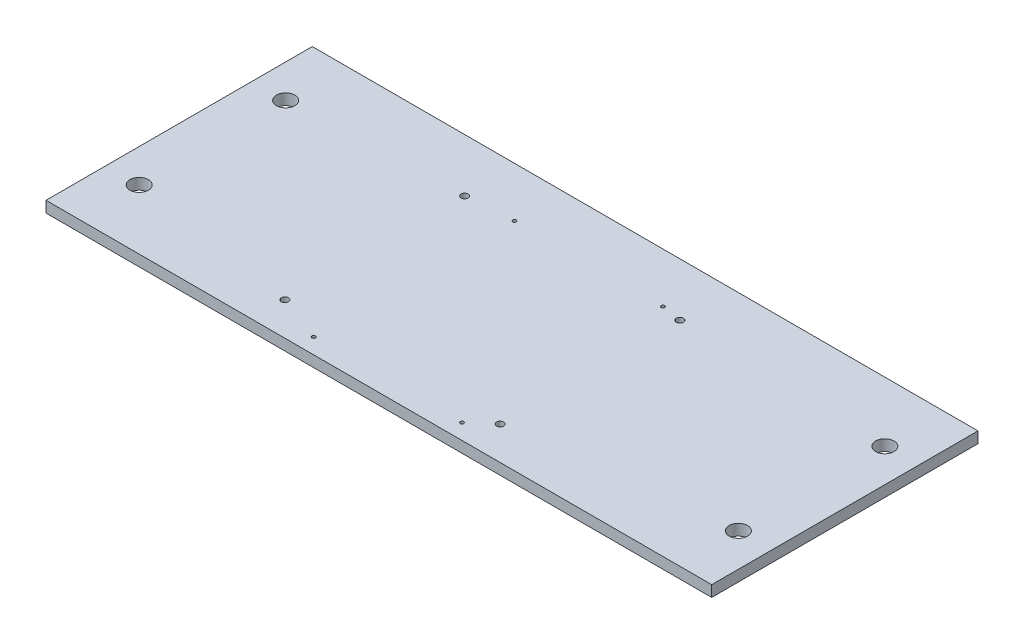
from build123d import *

# Parameters (mm, degrees)
SKETCH1_W               = 300
SKETCH1_H               = 120
BOSS_EXTRUDE1_DEPTH     = 5
TAP_DRILL_FOR_M2_TAP1_D = 1.6
M3_CLEARANCE_HOLE1_D    = 3.2
SKETCH2_R               = 4.15
CUT_EXTRUDE1_DEPTH      = 324.148572641


with BuildPart() as part:
    # Sketch1 → Boss-Extrude1 (new body)
    with BuildSketch(Plane(origin=(0, 0, 0), x_dir=(1, 0, 0), z_dir=(0, 1, 0))):
        with Locations((150, -60)):
            Rectangle(SKETCH1_W, SKETCH1_H)
    extrude(amount=BOSS_EXTRUDE1_DEPTH)

    # Tap Drill for M2 Tap1 (through all)
    with Locations(Plane(origin=(0, 5, 0), x_dir=(1, 0, 0), z_dir=(0, 1, 0))):
        with Locations((113.641894276, -112.9946), (180.474494276, -112.9946), (180.474494276, -22.4976), (113.641894276, -22.4976)):
            Hole(TAP_DRILL_FOR_M2_TAP1_D / 2)

    # M3 Clearance Hole1 (through all)
    with Locations(Plane(origin=(0, 5, 0), x_dir=(1, 0, 0), z_dir=(0, 1, 0))):
        with Locations((92.641894276, -105), (92.641894276, -24), (189.641894276, -24), (189.641894276, -105)):
            Hole(M3_CLEARANCE_HOLE1_D / 2)

    # Sketch2 → Cut-Extrude1 (cut, through all)
    with BuildSketch(Plane(origin=(0, 5, 0), x_dir=(1, 0, 0), z_dir=(0, 1, 0))):
        with Locations(Location((15, -27, 0), (0, 0, 270))):
            Circle(SKETCH2_R)
        with Locations(Location((285, -27, 0), (0, 0, 90))):
            Circle(SKETCH2_R)
        with Locations(Location((285, -93, 0), (0, 0, 270))):
            Circle(SKETCH2_R)
        with Locations(Location((15, -93, 0), (0, 0, 90))):
            Circle(SKETCH2_R)
    extrude(amount=-CUT_EXTRUDE1_DEPTH, mode=Mode.SUBTRACT)


solid = part.part
